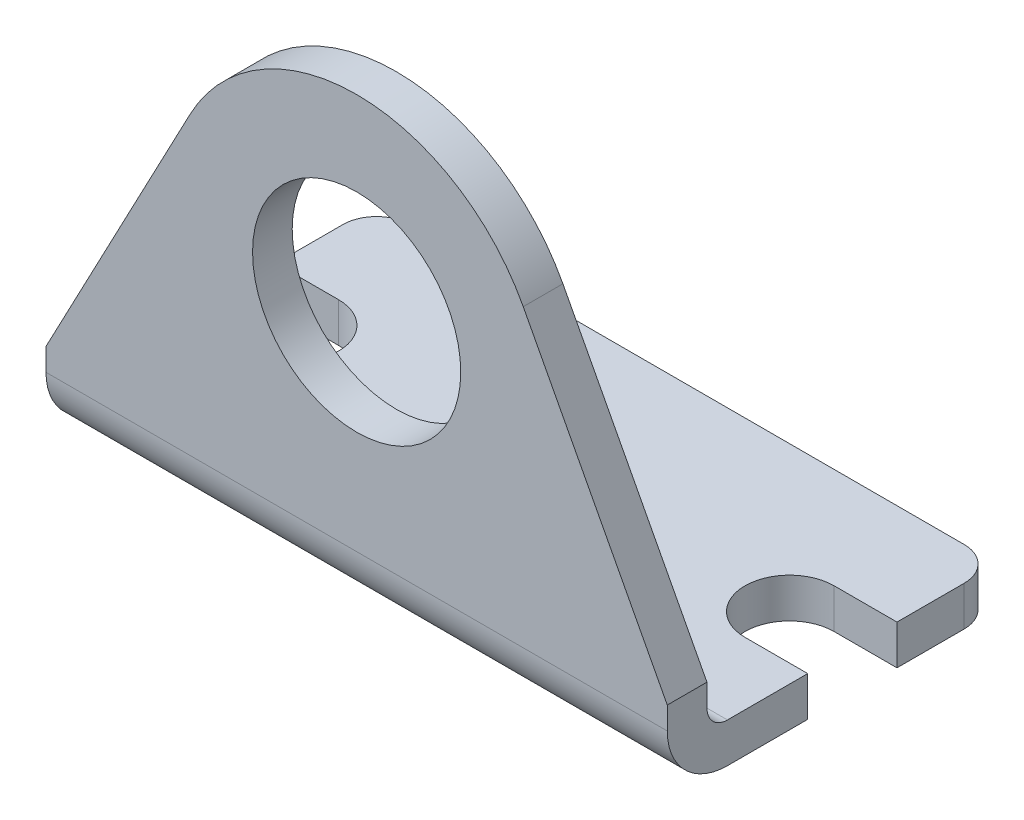
from build123d import *

# Parameters (mm, degrees)
SKETCH1_R           = 8.001
BOSS_EXTRUDE1_DEPTH = 3.048
BOSS_EXTRUDE2_DEPTH = 3.048
FILLET1_R           = 1.5748
FILLET2_R           = 4.6228


with BuildPart() as part:
    # Sketch1 → Boss-Extrude1 (new body)
    with BuildSketch(Plane.XY):
        with BuildLine():
            Line((-23.876, 6.35), (-12.804579401, 27.330865424))
            ThreePointArc((-12.804579401, 27.330865424), (0, 35.052), (12.804579401, 27.330865424))
            Line((12.804579401, 27.330865424), (23.876, 6.35))
            Line((23.876, 6.35), (23.876, 0))
            Line((23.876, 0), (-23.876, 0))
            Line((-23.876, 0), (-23.876, 6.35))
        make_face()
        with Locations((0, 20.574)):
            Circle(SKETCH1_R, mode=Mode.SUBTRACT)
    extrude(amount=-BOSS_EXTRUDE1_DEPTH)

    # Sketch2 → Boss-Extrude2 (add)
    with BuildSketch(Plane.XZ):
        with BuildLine():
            Line((23.876, -10.795), (19.05, -10.795))
            ThreePointArc((19.05, -10.795), (15.621, -14.224), (19.05, -17.653))
            Line((19.05, -17.653), (23.876, -17.653))
            Line((23.876, -17.653), (23.876, -22.817666667))
            ThreePointArc((23.876, -22.817666667), (23.119652078, -24.643652078), (21.293666667, -25.4))
            Line((21.293666667, -25.4), (-21.293666667, -25.4))
            ThreePointArc((-21.293666667, -25.4), (-23.119652078, -24.643652078), (-23.876, -22.817666667))
            Line((-23.876, -22.817666667), (-23.876, -17.653))
            Line((-23.876, -17.653), (-19.05, -17.653))
            ThreePointArc((-19.05, -17.653), (-15.621, -14.224), (-19.05, -10.795))
            Line((-19.05, -10.795), (-23.876, -10.795))
            Line((-23.876, -10.795), (-23.876, 0))
            Line((-23.876, 0), (23.876, 0))
            Line((23.876, 0), (23.876, -10.795))
        make_face()
    extrude(amount=-BOSS_EXTRUDE2_DEPTH)

    # Fillet1
    fillet1_edges = [part.edges().sort_by_distance(p)[0] for p in [
        (0, 3.048, -3.048),
    ]]
    fillet(fillet1_edges, radius=FILLET1_R)

    # Fillet2
    fillet2_edges = [part.edges().sort_by_distance(p)[0] for p in [
        (0, 0, 0),
    ]]
    fillet(fillet2_edges, radius=FILLET2_R)


solid = part.part
